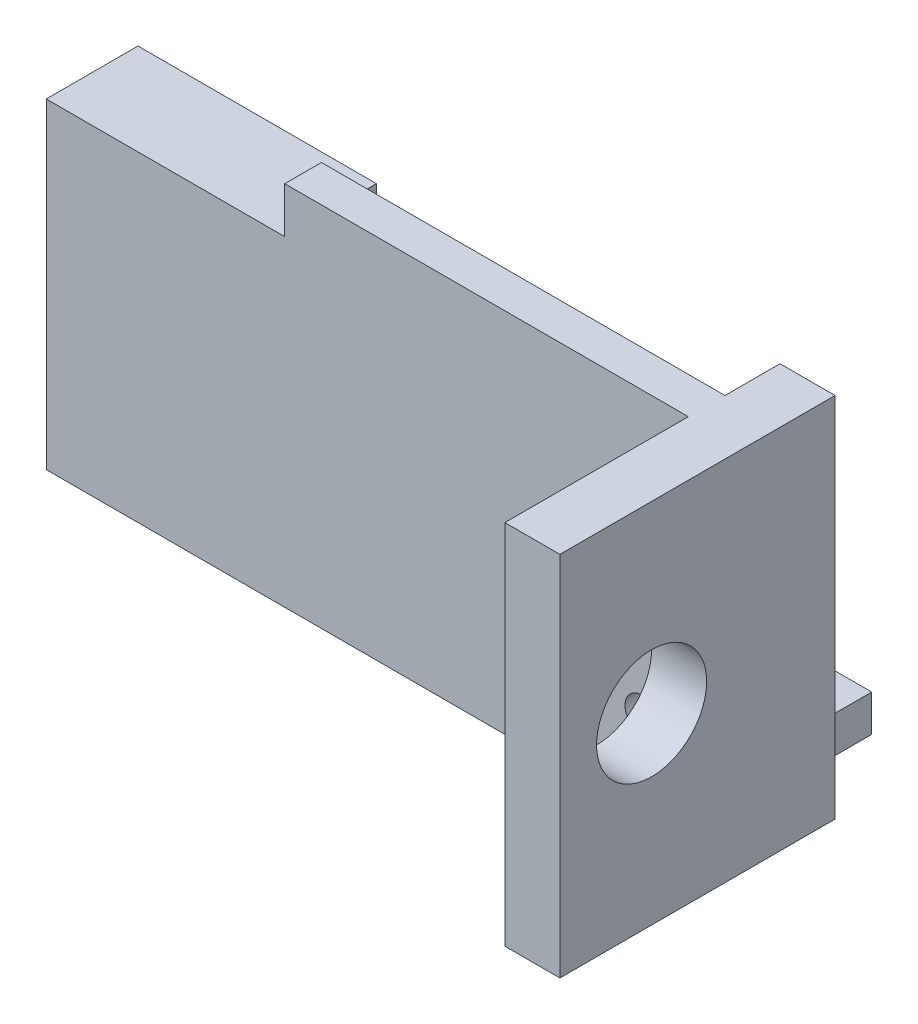
from build123d import *
from build123d.topology import SkipClean

# Parameters (mm, degrees)
SKETCH_1_R      = 0.95
EXTRUDE_1_DEPTH = 2
EXTRUDE_START   = 3
SKETCH_2_W      = 8
SKETCH_2_H      = 5
SKETCH_2_R      = 0.95
SKETCH_2_W_2    = 13
SKETCH_2_H_2    = 3.5
EXTRUDE_2_DEPTH = 3
SKETCH_4_W      = 35
SKETCH_4_H      = 10
EXTRUDE_3_DEPTH = 2
SKETCH_5_W      = 15
SKETCH_5_H      = 20
SKETCH_5_R      = 3
EXTRUDE_4_DEPTH = 3


with BuildPart() as part:
    # 草图1 → 凸台-拉伸1 (new body)
    with BuildSketch(Plane.XY):
        Polygon((-17.5, 6.5), (-4.5, 6.5), (-4.5, 9), (17.5, 9), (17.5, -9), (-17.5, -9), align=None)
        with Locations((15, -6.35)):
            Circle(SKETCH_1_R, mode=Mode.SUBTRACT)
    extrude(amount=EXTRUDE_1_DEPTH)

    # 草图2 → 凸台-拉伸2 (add)
    # profile 1 of 2: a face of its own
    with SkipClean():  # the faces are left unmerged after this step: merging them gives an invalid solid
        with BuildSketch(Plane(origin=(0, 0, 0), x_dir=(-1, 0, 0), z_dir=(0, 0, -1)).offset(EXTRUDE_START)):
            with Locations((-13.5, -6.5)):
                Rectangle(SKETCH_2_W, SKETCH_2_H)
            with Locations((-15, -6.35)):
                Circle(SKETCH_2_R, mode=Mode.SUBTRACT)
        # profile 2 of 2: a face of its own
        with BuildSketch(Plane(origin=(0, 0, 0), x_dir=(-1, 0, 0), z_dir=(0, 0, -1)).offset(EXTRUDE_START)):
            with Locations((11, 4.75)):
                Rectangle(SKETCH_2_W_2, SKETCH_2_H_2)
        extrude(amount=-EXTRUDE_2_DEPTH)

    # 草图4 → 凸台-拉伸3 (add)
    with SkipClean():  # the faces are left unmerged after this step: merging them gives an invalid solid
        with BuildSketch(Plane.XZ.offset(9)):
            with Locations((0, -3)):
                Rectangle(SKETCH_4_W, SKETCH_4_H)
        extrude(amount=EXTRUDE_3_DEPTH)

    # 草图5 → 凸台-拉伸4 (add)
    with SkipClean():  # the faces are left unmerged after this step: merging them gives an invalid solid
        with BuildSketch(Plane(origin=(17.5, 0, 0), x_dir=(0, 0, -1), z_dir=(1, 0, 0))):
            with Locations((-4.5, -1)):
                Rectangle(SKETCH_5_W, SKETCH_5_H)
            with Locations((-7, -1)):
                Circle(SKETCH_5_R, mode=Mode.SUBTRACT)
        extrude(amount=EXTRUDE_4_DEPTH)


solid = part.part
